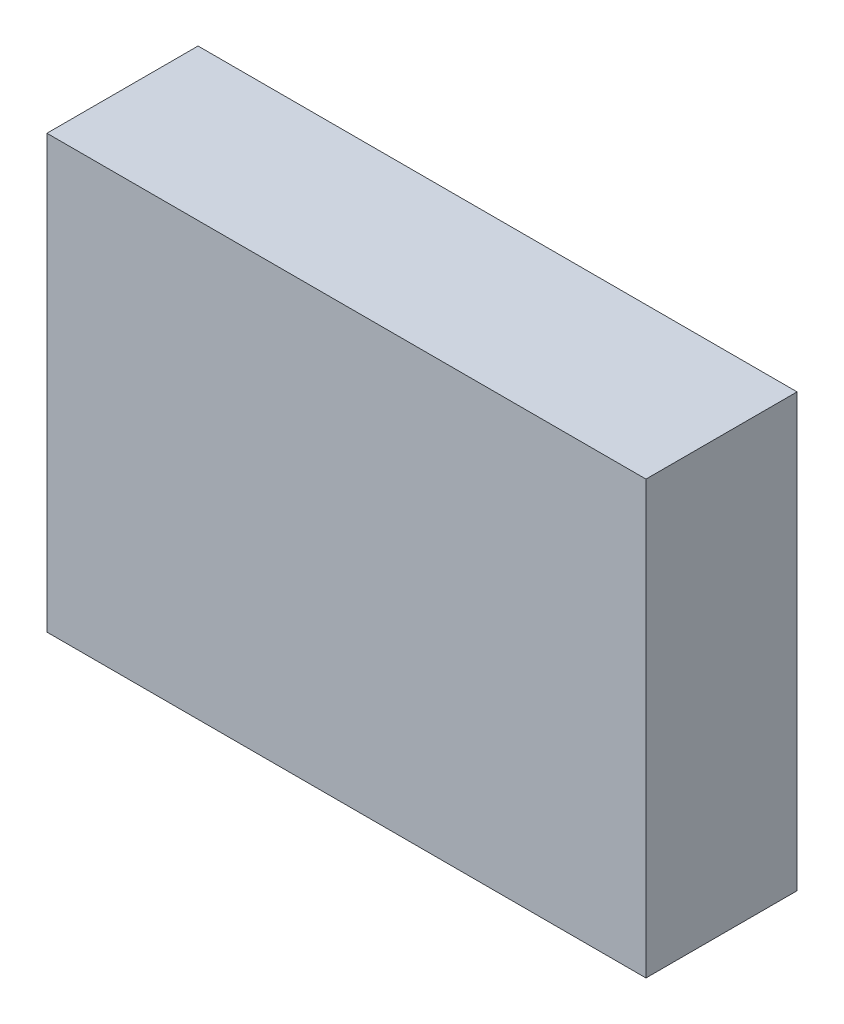
from build123d import *

# Parameters (mm, degrees)
ESBO_O1_W                = 39.64468576
ESBO_O1_H                = 28.594921016
RESSALTO_EXTRUS_O1_DEPTH = 5


with BuildPart() as part:
    # Esboço1 → Ressalto-extrusão1 (new, symmetric)
    with BuildSketch(Plane.XY):
        Rectangle(ESBO_O1_W, ESBO_O1_H)
    extrude(amount=RESSALTO_EXTRUS_O1_DEPTH, both=True)


solid = part.part
